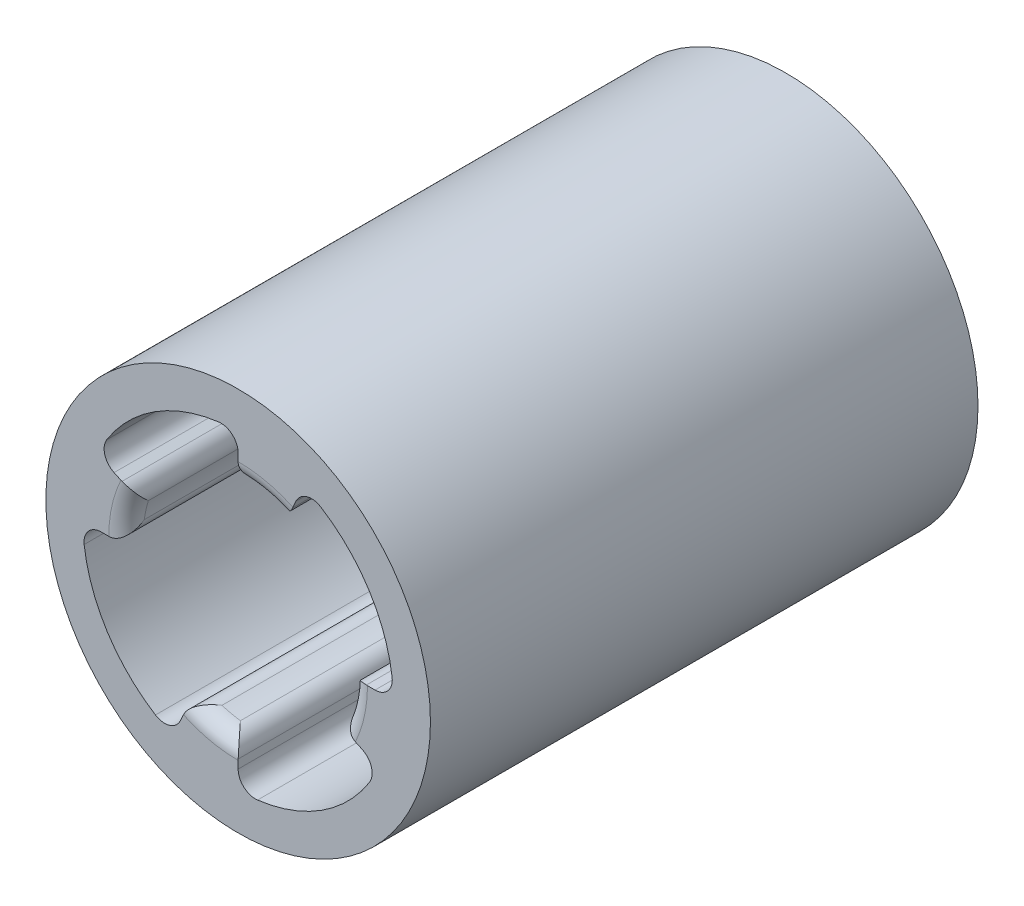
from build123d import *

# Parameters (mm, degrees)
SKETCH1_R           = 11.15
BOSS_EXTRUDE1_DEPTH = 31.75
CUT_EXTRUDE4_DEPTH  = 36.450070522
FILLET2_R           = 1
FILLET4_R           = 1


with BuildPart() as part:
    # Sketch1 → Boss-Extrude1 (new body)
    with BuildSketch(Plane.XY):
        Circle(SKETCH1_R)
    extrude(amount=BOSS_EXTRUDE1_DEPTH)

    # Sketch2 → Cut-Extrude4 (cut, through all)
    with BuildSketch(Plane.XY):
        with BuildLine():
            Line((0, 6.5), (0, 9))
            ThreePointArc((0, 9), (-4.835696475, 7.590523012), (-8.156770083, 3.803564356))
            Line((-8.156770083, 3.803564356), (-5.891000616, 2.747018701))
            ThreePointArc((-5.891000616, 2.747018701), (-6.345924046, 1.406857491), (-6.5, 0))
            Line((-6.5, 0), (-9, 0))
            ThreePointArc((-9, 0), (-7.590523012, -4.835696475), (-3.803564356, -8.156770083))
            Line((-3.803564356, -8.156770083), (-2.747018701, -5.891000616))
            ThreePointArc((-2.747018701, -5.891000616), (-1.406857491, -6.345924046), (0, -6.5))
            Line((0, -6.5), (0, -9))
            ThreePointArc((0, -9), (4.835696475, -7.590523012), (8.156770083, -3.803564356))
            Line((8.156770083, -3.803564356), (5.891000616, -2.747018701))
            ThreePointArc((5.891000616, -2.747018701), (6.345924046, -1.406857491), (6.5, 0))
            Line((6.5, 0), (9, 0))
            ThreePointArc((9, 0), (7.590523012, 4.835696475), (3.803564356, 8.156770083))
            Line((3.803564356, 8.156770083), (2.747018701, 5.891000616))
            ThreePointArc((2.747018701, 5.891000616), (1.406857491, 6.345924046), (0, 6.5))
        make_face()
    extrude(amount=CUT_EXTRUDE4_DEPTH, mode=Mode.SUBTRACT)

    # Fillet2
    fillet2_edges = [part.edges().sort_by_distance(p)[0] for p in [
        (6.345924046, -1.406857491, 0),
        (5.891000616, -2.747018701, 15.875),
        (6.5, 0, 15.875),
        (1.406857491, 6.345924046, 0),
        (2.747018701, 5.891000616, 15.875),
        (0, 6.5, 15.875),
        (-6.345924046, 1.406857491, 0),
        (-5.891000616, 2.747018701, 15.875),
        (-6.5, 0, 15.875),
        (-1.406857491, -6.345924046, 0),
        (-2.747018701, -5.891000616, 15.875),
        (0, -6.5, 15.875),
        (6.345924046, -1.406857491, 31.75),
        (1.406857491, 6.345924046, 31.75),
        (-6.345924046, 1.406857491, 31.75),
        (-1.406857491, -6.345924046, 31.75),
    ]]
    fillet(fillet2_edges, radius=FILLET2_R)

    # Fillet4
    fillet4_edges = [part.edges().sort_by_distance(p)[0] for p in [
        (9, 0, 15.875),
        (3.803564356, 8.156770083, 15.875),
        (0, 9, 15.875),
        (-8.156770083, 3.803564356, 15.875),
        (-9, 0, 15.875),
        (-3.803564356, -8.156770083, 15.875),
        (0, -9, 15.875),
        (8.156770083, -3.803564356, 15.875),
    ]]
    fillet(fillet4_edges, radius=FILLET4_R)


solid = part.part
